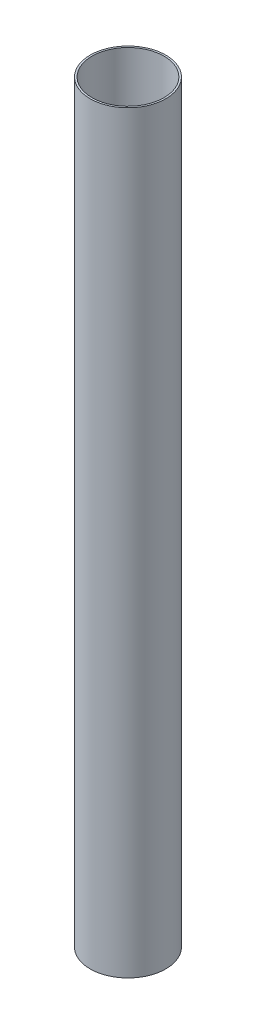
from build123d import *

# Parameters (mm, degrees)
SKETCH1_R           = 25.1
SKETCH1_R_2         = 23.9
BOSS_EXTRUDE1_DEPTH = 500


with BuildPart() as part:
    # Sketch1 → Boss-Extrude1 (new body)
    with BuildSketch(Plane(origin=(0, 0, 0), x_dir=(1, 0, 0), z_dir=(0, 1, 0))):
        with Locations(Location((0, 0, 0), (0, 0, 270))):
            Circle(SKETCH1_R)
        with Locations(Location((0, 0, 0), (0, 0, 270))):
            Circle(SKETCH1_R_2, mode=Mode.SUBTRACT)
    extrude(amount=BOSS_EXTRUDE1_DEPTH)


solid = part.part
